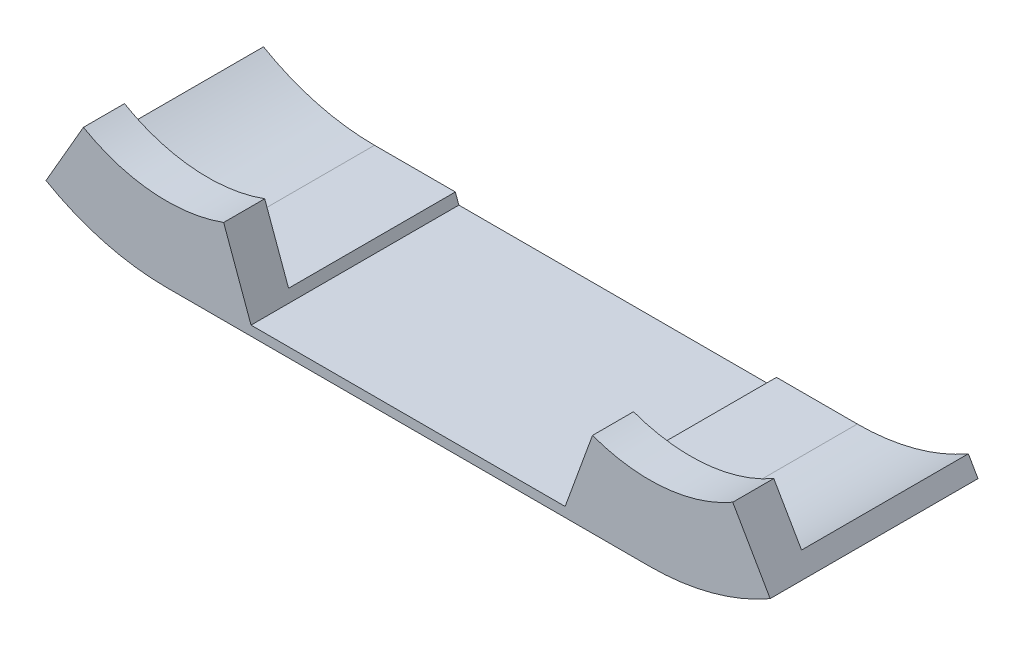
from build123d import *

# Parameters (mm, degrees)
EXTRUDE_1_DEPTH = 8.5
EXTRUDE_START   = -34.55
EXTRUDE_5_DEPTH = 34.55


with BuildPart() as part:
    # 草图1 → 凸台-拉伸1 (new body)
    with BuildSketch(Plane.XY):
        with BuildLine():
            Line((0, -50), (25, -50))
            Line((25, -50), (75, -50))
            Line((75, -50), (100, -50))
            ThreePointArc((100, -50), (112.940952255, -48.296291314), (125, -43.301270189))
            Line((125, -43.301270189), (117.25, -29.877876431))
            ThreePointArc((117.25, -29.877876431), (108.929257056, -33.324441007), (100, -34.5))
            ThreePointArc((100, -34.5), (94.00913787, -33.975867479), (88.200305055, -32.419395417))
            Line((88.200305055, -32.419395417), (82.529428755, -48))
            Line((82.529428755, -48), (75, -48))
            Line((75, -48), (25, -48))
            Line((25, -48), (17.470571245, -48))
            Line((17.470571245, -48), (11.799694945, -32.419395417))
            ThreePointArc((11.799694945, -32.419395417), (5.99086213, -33.975867479), (0, -34.5))
            ThreePointArc((0, -34.5), (-8.929257056, -33.324441007), (-17.25, -29.877876431))
            Line((-17.25, -29.877876431), (-25, -43.301270189))
            ThreePointArc((-25, -43.301270189), (-12.940952255, -48.296291314), (0, -50))
        make_face()
    extrude(amount=EXTRUDE_1_DEPTH)

    # 草图3 → 凸台-拉伸5 (add)
    with BuildSketch(Plane.XY.offset(EXTRUDE_START)):
        with BuildLine():
            Line((-23, -39.837168574), (-25, -43.301270189))
            ThreePointArc((-25, -43.301270189), (-12.940952255, -48.296291314), (0, -50))
            Line((0, -50), (100, -50))
            ThreePointArc((100, -50), (112.940952255, -48.296291314), (125, -43.301270189))
            Line((125, -43.301270189), (123, -39.837168574))
            ThreePointArc((123, -39.837168574), (111.905676075, -44.432588009), (100, -46))
            Line((100, -46), (83.257369224, -46))
            Line((83.257369224, -46), (82.529428755, -48))
            Line((82.529428755, -48), (17.470571245, -48))
            Line((17.470571245, -48), (16.742630776, -46))
            Line((16.742630776, -46), (0, -46))
            ThreePointArc((0, -46), (-11.905676075, -44.432588009), (-23, -39.837168574))
        make_face()
    extrude(amount=EXTRUDE_5_DEPTH)


solid = part.part
